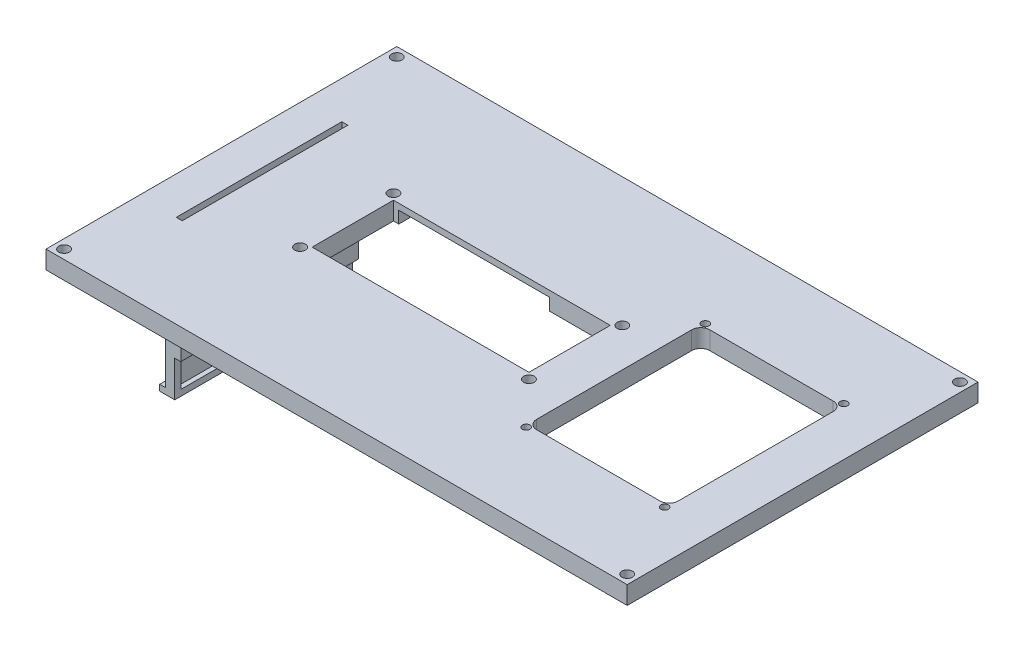
from build123d import *

# Parameters (mm, degrees)
SKETCH1_W            = 193
SKETCH1_H            = 116.5
SKETCH1_R            = 1.75
SKETCH1_W_2          = 47
SKETCH1_H_2          = 57.5
SKETCH1_W_3          = 72
SKETCH1_H_3          = 27
SKETCH1_W_4          = 2
SKETCH1_H_4          = 55
BOSS_EXTRUDE1_DEPTH  = 6
SKETCH3_W            = 10
SKETCH3_H            = 10
BOSS_EXTRUDE3_DEPTH  = 10
FILLET1_R            = 3
SKETCH5_W            = 2
SKETCH5_H            = 55
BOSS_EXTRUDE4_DEPTH  = 6
SKETCH6_W            = 181
SKETCH6_H            = 104.5
CUT_EXTRUDE1_DEPTH   = 4
SKETCH7_W            = 1.5
SKETCH7_H            = 55
BOSS_EXTRUDE5_DEPTH  = 44.75
SKETCH8_W            = 2
SKETCH8_H            = 55
CUT_EXTRUDE2_DEPTH   = 42.25
SKETCH10_W           = 6
SKETCH10_H           = 19
CUT_EXTRUDE3_DEPTH   = 4
FILLET3_R            = 3
SKETCH12_W           = 55
SKETCH12_H           = 2
BOSS_EXTRUDE6_DEPTH  = 1.5
SKETCH14_W           = 3
SKETCH14_H           = 44.75
BOSS_EXTRUDE7_DEPTH  = 2
SKETCH15_W           = 3
SKETCH15_H           = 44.75
BOSS_EXTRUDE8_DEPTH  = 2
BOSS_EXTRUDE9_DEPTH  = 2
SKETCH17_R           = 1.25
CUT_EXTRUDE5_DEPTH   = 6
SKETCH18_W           = 20
SKETCH18_H           = 32.75
BOSS_EXTRUDE10_DEPTH = 2
SKETCH19_W           = 50
SKETCH19_H           = 37
CUT_EXTRUDE7_DEPTH   = 4


with BuildPart() as part:
    # Sketch1 → Boss-Extrude1 (new body)
    with BuildSketch(Plane(origin=(0, 0, 0), x_dir=(1, 0, 0), z_dir=(0, 1, 0))):
        with Locations((22.87983871, -17.078434096)):
            Rectangle(SKETCH1_W, SKETCH1_H)
        with Locations(Location((-31.988235573, -1.578434096, 0), (0, 0, 270))):
            Circle(SKETCH1_R, mode=Mode.SUBTRACT)
        with Locations(Location((-31.988235573, -32.578434096, 0), (0, 0, 270))):
            Circle(SKETCH1_R, mode=Mode.SUBTRACT)
        with Locations(Location((44.011764427, -1.578434096, 0), (0, 0, 270))):
            Circle(SKETCH1_R, mode=Mode.SUBTRACT)
        with Locations(Location((44.011764427, -32.578434096, 0), (0, 0, 270))):
            Circle(SKETCH1_R, mode=Mode.SUBTRACT)
        with Locations(Location((-70.62016129, -72.328434096, 0), (0, 0, 270))):
            Circle(SKETCH1_R, mode=Mode.SUBTRACT)
        with Locations(Location((-70.62016129, 38.171565904, 0), (0, 0, 270))):
            Circle(SKETCH1_R, mode=Mode.SUBTRACT)
        with Locations(Location((116.37983871, -72.328434096, 0), (0, 0, 270))):
            Circle(SKETCH1_R, mode=Mode.SUBTRACT)
        with Locations(Location((116.37983871, 38.171565904, 0), (0, 0, 270))):
            Circle(SKETCH1_R, mode=Mode.SUBTRACT)
        with Locations((80.308659112, -17.078434096)):
            Rectangle(SKETCH1_W_2, SKETCH1_H_2, mode=Mode.SUBTRACT)
        with Locations((6.011764427, -17.078434096)):
            Rectangle(SKETCH1_W_3, SKETCH1_H_3, mode=Mode.SUBTRACT)
        with Locations((-47.331266899, -17.078434096)):
            Rectangle(SKETCH1_W_4, SKETCH1_H_4, mode=Mode.SUBTRACT)
    extrude(amount=BOSS_EXTRUDE1_DEPTH)

    # Sketch3 → Boss-Extrude3 (add)
    with BuildSketch(Plane.XZ):
        with Locations((-62.62016129, 64.328434096)):
            Rectangle(SKETCH3_W, SKETCH3_H)
        with Locations((-62.62016129, -30.171565904)):
            Rectangle(SKETCH3_W, SKETCH3_H)
        with Locations((108.37983871, -30.171565904)):
            Rectangle(SKETCH3_W, SKETCH3_H)
        with Locations((108.37983871, 64.328434096)):
            Rectangle(SKETCH3_W, SKETCH3_H)
    extrude(amount=BOSS_EXTRUDE3_DEPTH)

    # Fillet1
    fillet1_edges = [part.edges().sort_by_distance(p)[0] for p in [
        (56.808659112, 3, -11.671565904),
        (56.808659112, 3, 45.828434096),
        (103.808659112, 3, 45.828434096),
        (103.808659112, 3, -11.671565904),
    ]]
    fillet(fillet1_edges, radius=FILLET1_R)

    # Sketch5 → Boss-Extrude4 (add)
    with BuildSketch(Plane.XZ):
        with Locations((-47.331266899, 17.078434096)):
            Rectangle(SKETCH5_W, SKETCH5_H)
    extrude(amount=-BOSS_EXTRUDE4_DEPTH)

    # Sketch6 → Cut-Extrude1 (cut)
    with BuildSketch(Plane.XZ.offset(10)):
        with Locations((22.87983871, 17.078434096)):
            Rectangle(SKETCH6_W, SKETCH6_H)
    extrude(amount=-CUT_EXTRUDE1_DEPTH, mode=Mode.SUBTRACT)

    # Sketch7 → Boss-Extrude5 (add)
    with BuildSketch(Plane.XZ):
        with Locations((-61.87016129, 17.078434096)):
            Rectangle(SKETCH7_W, SKETCH7_H)
    extrude(amount=BOSS_EXTRUDE5_DEPTH)

    # Sketch8 → Cut-Extrude2 (cut)
    with BuildSketch(Plane.XZ):
        with Locations((-60.12016129, 17.078434096)):
            Rectangle(SKETCH8_W, SKETCH8_H)
    extrude(amount=-CUT_EXTRUDE2_DEPTH, mode=Mode.SUBTRACT)

    # Sketch10 → Cut-Extrude3 (cut)
    with BuildSketch(Plane.XZ):
        with Locations((45.011764427, 17.078434096)):
            Rectangle(SKETCH10_W, SKETCH10_H)
    extrude(amount=-CUT_EXTRUDE3_DEPTH, mode=Mode.SUBTRACT)

    # Fillet3
    fillet3_edges = [part.edges().sort_by_distance(p)[0] for p in [
        (-67.62016129, -6, 64.328434096),
        (-67.62016129, -6, -30.171565904),
        (-62.62016129, -6, -35.171565904),
        (108.37983871, -6, -35.171565904),
        (-62.62016129, -6, 69.328434096),
        (108.37983871, -6, 69.328434096),
        (113.37983871, -6, -30.171565904),
        (113.37983871, -6, 64.328434096),
        (-62.62016129, -6, 59.328434096),
        (-57.62016129, -6, 64.328434096),
        (103.37983871, -6, 64.328434096),
        (108.37983871, -6, 59.328434096),
        (108.37983871, -6, -25.171565904),
        (103.37983871, -6, -30.171565904),
        (-57.62016129, -6, -30.171565904),
        (-62.62016129, -6, -25.171565904),
    ]]
    fillet(fillet3_edges, radius=FILLET3_R)

    # Sketch12 → Boss-Extrude6 (add)
    with BuildSketch(Plane(origin=(-61.12016129, 0, 0), x_dir=(0, 0, -1), z_dir=(1, 0, 0))):
        with Locations((-17.078434096, -43.75)):
            Rectangle(SKETCH12_W, SKETCH12_H)
    extrude(amount=BOSS_EXTRUDE6_DEPTH)

    # Sketch14 → Boss-Extrude7 (add)
    with BuildSketch(Plane(origin=(0, 0, -10.421565904), x_dir=(-1, 0, 0), z_dir=(0, 0, -1))):
        with Locations((61.12016129, -22.375)):
            Rectangle(SKETCH14_W, SKETCH14_H)
    extrude(amount=BOSS_EXTRUDE7_DEPTH)

    # Sketch15 → Boss-Extrude8 (add)
    with BuildSketch(Plane.XY.offset(44.578434096)):
        with Locations((-61.12016129, -22.375)):
            Rectangle(SKETCH15_W, SKETCH15_H)
    extrude(amount=BOSS_EXTRUDE8_DEPTH)

    # Sketch16 → Boss-Extrude9 (add)
    with BuildSketch(Plane.ZY.offset(62.62016129)):
        Polygon((-10.421565904, 0), (-10.421565904, -42.75), (46.578434096, -42.75), (46.578434096, -44.75), (-12.421565904, -44.75), (-12.421565904, 0), align=None)
    extrude(amount=BOSS_EXTRUDE9_DEPTH)

    # Sketch17 → Cut-Extrude5 (cut)
    with BuildSketch(Plane(origin=(0, 6, 0), x_dir=(1, 0, 0), z_dir=(0, 1, 0))):
        with Locations(Location((57.308659112, 12.671565904, 0), (0, 0, 270))):
            Circle(SKETCH17_R)
        with Locations(Location((103.308659112, 12.671565904, 0), (0, 0, 270))):
            Circle(SKETCH17_R)
        with Locations(Location((57.308659112, -46.828434096, 0), (0, 0, 270))):
            Circle(SKETCH17_R)
        with Locations(Location((103.308659112, -46.828434096, 0), (0, 0, 270))):
            Circle(SKETCH17_R)
    extrude(amount=-CUT_EXTRUDE5_DEPTH, mode=Mode.SUBTRACT)

    # Sketch18 → Boss-Extrude10 (add)
    with BuildSketch(Plane(origin=(-59.62016129, 0, 0), x_dir=(0, 0, -1), z_dir=(1, 0, 0))):
        with Locations((-36.578434096, -16.375)):
            Rectangle(SKETCH18_W, SKETCH18_H)
        with Locations((2.421565904, -16.375)):
            Rectangle(SKETCH18_W, SKETCH18_H)
    extrude(amount=BOSS_EXTRUDE10_DEPTH)

    # Sketch19 → Cut-Extrude7 (cut)
    with BuildSketch(Plane.XZ):
        with Locations((-3.238235573, 17.078434096)):
            Rectangle(SKETCH19_W, SKETCH19_H)
    extrude(amount=-CUT_EXTRUDE7_DEPTH, mode=Mode.SUBTRACT)


solid = part.part
